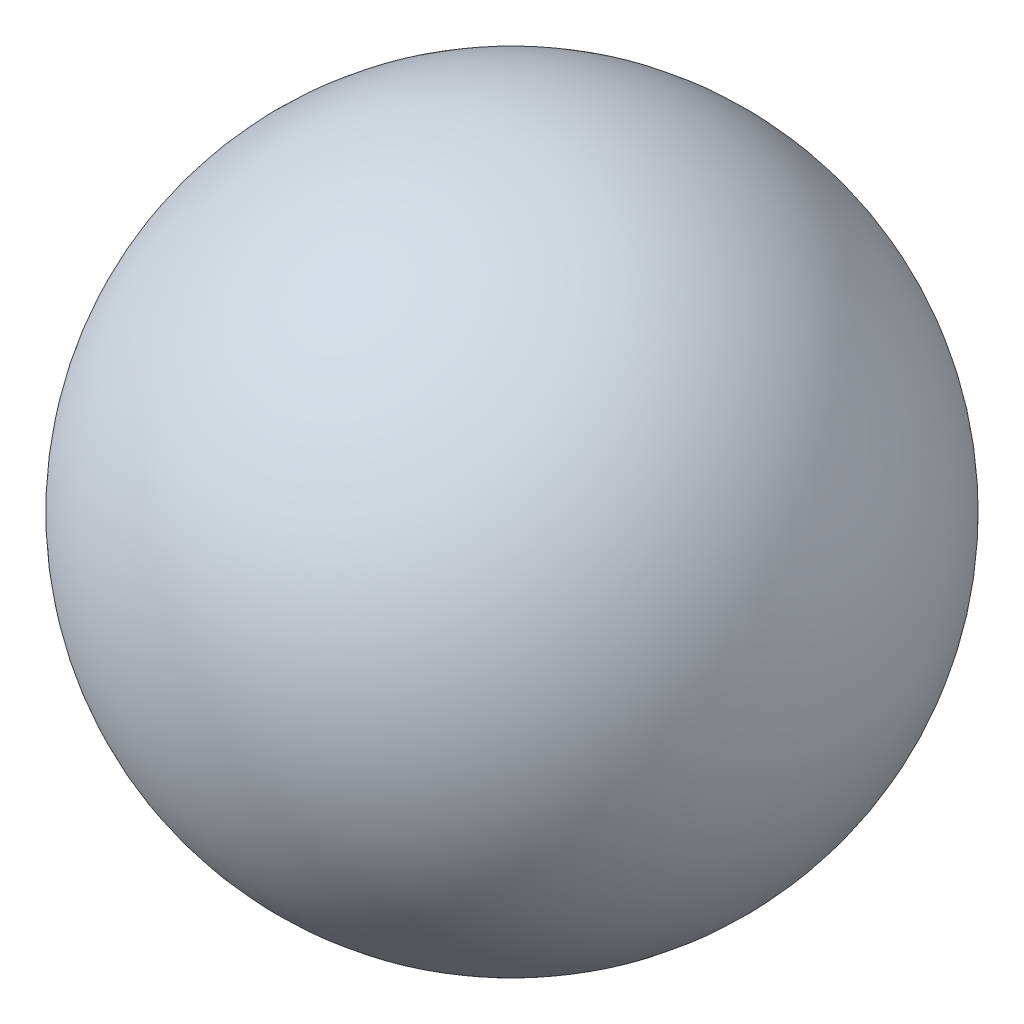
from build123d import *


with BuildPart() as part:
    # Sketch1 → Revolve1 (revolve)
    with BuildSketch(Plane.XY):
        with BuildLine():
            Line((0, -19.05), (0, 19.05))
            ThreePointArc((0, 19.05), (19.05, 0), (0, -19.05))
        make_face()
    revolve(axis=Axis((0, -19.05, 0), (0, 1, 0)))


solid = part.part
